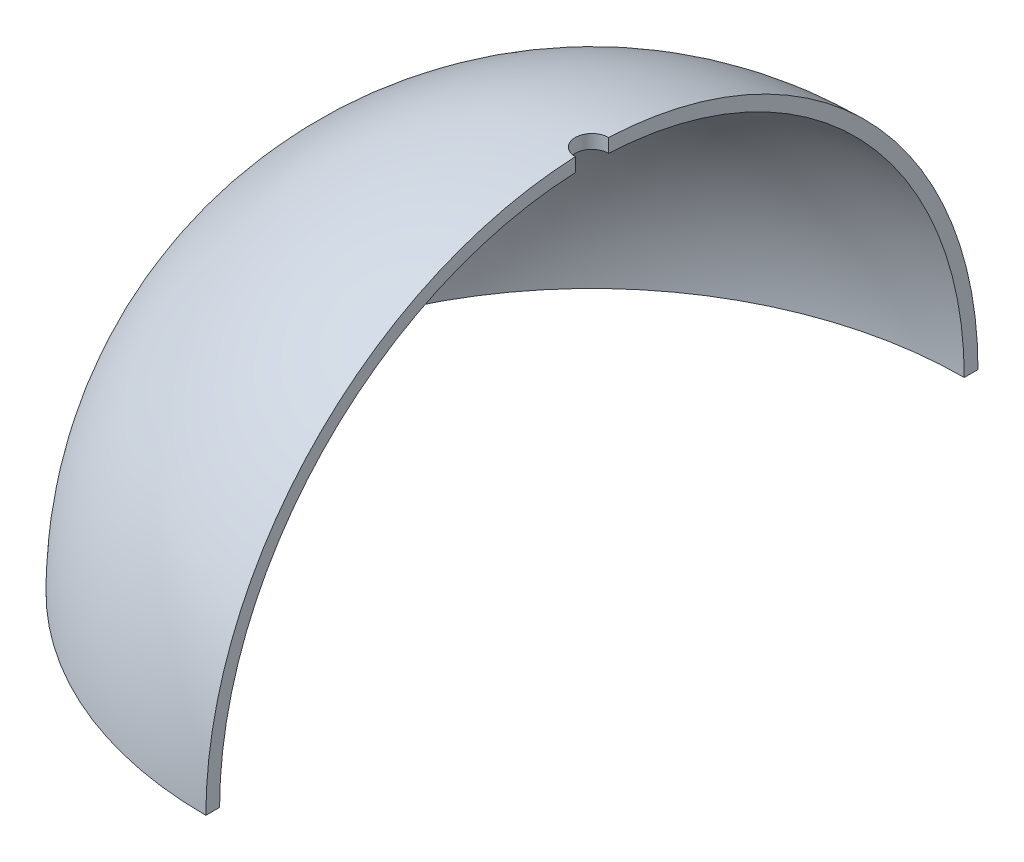
from build123d import *

# Parameters (mm, degrees)
REVOLVE1_ANGLE          = 90
CUT_EXTRUDE1_REACH      = 16066.771
CUT_EXTRUDE1_END_RADIUS = 9275
SKETCH2_R               = 400


with BuildPart() as part:
    # Sketch1 → Revolve1 (revolve)
    with BuildSketch(Plane(origin=(0, 0, 0), x_dir=(1, 0, 0), z_dir=(0, 1, 0))):
        with BuildLine():
            Line((0, 9275), (0, 8945))
            ThreePointArc((0, 8945), (-8945, 0), (0, -8945))
            Line((0, -8945), (0, -9275))
            ThreePointArc((0, -9275), (-9275, 0), (0, 9275))
        make_face()
    revolve(axis=Axis((0, 0, 41.715398803), (0, 0, -1)), revolution_arc=REVOLVE1_ANGLE)

    # Cut-Extrude1: up to this sphere (the profile starts inside it)
    cut_extrude1_end = Location((0, 0, 0)) * Sphere(CUT_EXTRUDE1_END_RADIUS, mode=Mode.PRIVATE)
    # Sketch2 → Cut-Extrude1 (cut, up to the surface)
    with BuildSketch(Plane(origin=(0, 0, 0), x_dir=(1, 0, 0), z_dir=(0, 1, 0)), mode=Mode.PRIVATE) as cut_extrude1_sk1:
        Circle(SKETCH2_R)
    cut_extrude1_tool1 = extrude(cut_extrude1_sk1.sketch, amount=CUT_EXTRUDE1_REACH, mode=Mode.PRIVATE) & cut_extrude1_end
    add(cut_extrude1_tool1.solids().sort_by_distance((0, 0, 0))[0], mode=Mode.SUBTRACT)


solid = part.part
